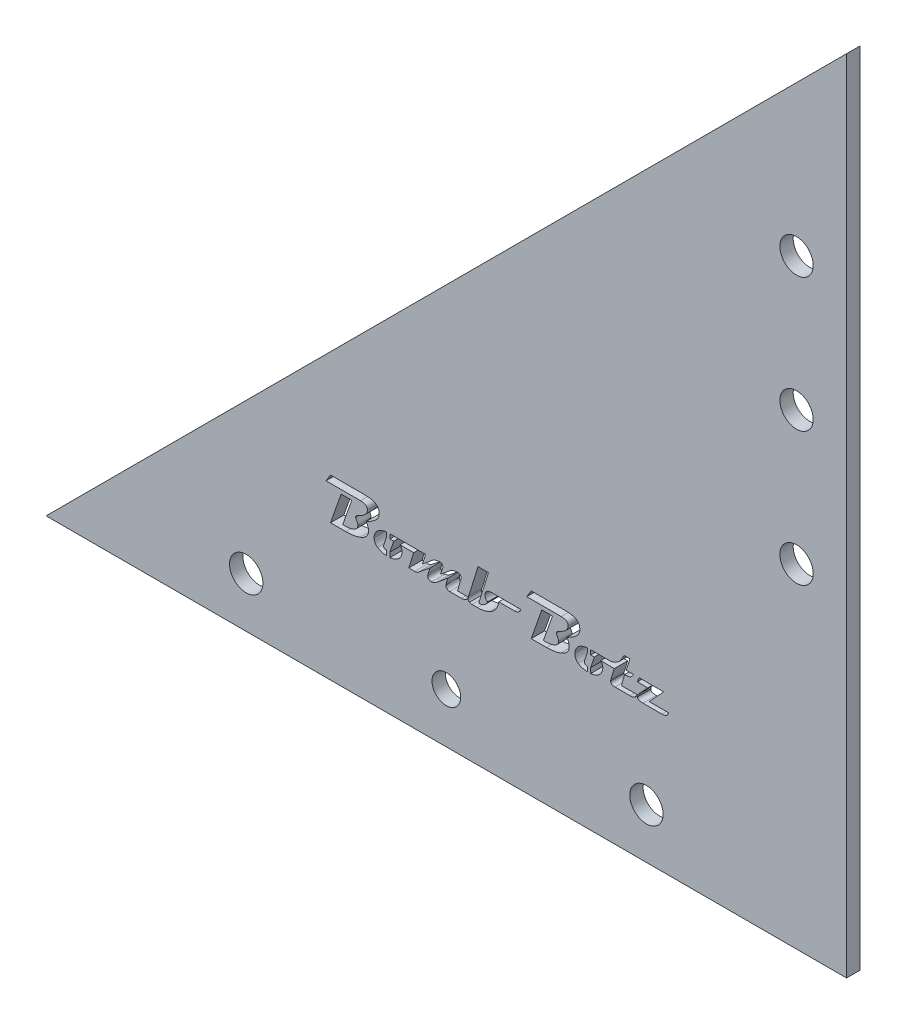
from build123d import *

# Parameters (mm, degrees)
BOSS_EXTRUDE4_DEPTH = 2.54
SKETCH5_R           = 3.175
SKETCH5_R_2         = 2.7305
CUT_EXTRUDE1_DEPTH  = 2.54
CUT_EXTRUDE2_DEPTH  = 2.54
SKETCH7_W           = 0.619174652
SKETCH7_H           = 6.165947576
SKETCH7_H_2         = 7.239183639
BOSS_EXTRUDE5_DEPTH = 2.54


with BuildPart() as part:
    # Sketch4 → Boss-Extrude4 (new body)
    with BuildSketch(Plane.XY):
        Polygon((0, 0), (-152.4, 0), (0, 152.4), align=None)
    extrude(amount=BOSS_EXTRUDE4_DEPTH)

    # Sketch5 → Cut-Extrude1 (cut)
    with BuildSketch(Plane.XY.offset(2.54)):
        with Locations((-114.3, 9.525)):
            Circle(SKETCH5_R)
        with Locations((-76.2, 9.525)):
            Circle(SKETCH5_R_2)
        with Locations((-38.1, 9.525)):
            Circle(SKETCH5_R)
        with Locations((-9.525, 63.5)):
            Circle(SKETCH5_R)
        with Locations((-9.525, 88.9)):
            Circle(SKETCH5_R)
        with Locations((-9.525, 114.3)):
            Circle(SKETCH5_R)
    extrude(amount=-CUT_EXTRUDE1_DEPTH, mode=Mode.SUBTRACT)

    # Sketch6 → Cut-Extrude2 (cut)
    # profile 1 of 8: a face of its own
    with BuildSketch(Plane.XY.offset(2.54)):
        with BuildLine():
            add(Edge.make_bspline(
                [(-88.990266717, 32.049532771), (-88.99258407, 31.981104975), (-88.997205929, 31.844628762), (-89.042360579, 31.64283784), (-89.108012122, 31.443323413), (-89.204491548, 31.247533619), (-89.328498389, 31.056607307), (-89.478600579, 30.868693199), (-89.655007282, 30.683858772), (-89.78806245, 30.568878389), (-89.856712742, 30.509553848)],
                knots=[0, 0, 0, 0, 0.897728408, 1.790479602, 2.704835107, 3.65271708, 4.64870854, 5.690615823, 6.808464946, 8, 8, 8, 8], degree=3))
            add(Edge.make_bspline(
                [(-89.856712742, 30.509553848), (-89.902357666, 30.472490027), (-89.997340119, 30.395363978), (-90.153487814, 30.284313315), (-90.325740995, 30.169660759), (-90.516604463, 30.054053788), (-90.721842787, 29.931972854), (-90.945553289, 29.809758188), (-91.184832705, 29.682348928), (-91.352088596, 29.600477238), (-91.43826777, 29.558292569)],
                knots=[0, 0, 0, 0, 0.762818378, 1.58734759, 2.485155294, 3.447475053, 4.482567251, 5.583716273, 6.755001493, 8, 8, 8, 8], degree=3))
            add(Edge.make_bspline(
                [(-91.43826777, 29.558292569), (-91.404391758, 29.49708212), (-91.338334323, 29.377723166), (-91.251975407, 29.197760359), (-91.177943071, 29.022629369), (-91.118122487, 28.851502433), (-91.071082218, 28.684928968), (-91.037519499, 28.522704698), (-91.01659801, 28.364777239), (-91.013867199, 28.260623631), (-91.012528456, 28.209563728)],
                knots=[0, 0, 0, 0, 1.174121996, 2.289510624, 3.348879741, 4.364175923, 5.330489301, 6.25208496, 7.143108216, 8, 8, 8, 8], degree=3))
            add(Edge.make_bspline(
                [(-91.012528456, 28.209563728), (-91.013948019, 28.158515543), (-91.016765299, 28.057204788), (-91.034910588, 27.90791384), (-91.066555381, 27.763624872), (-91.112116762, 27.625356879), (-91.168369313, 27.491269537), (-91.239041417, 27.363250082), (-91.320661802, 27.239241889), (-91.416060845, 27.120820998), (-91.524659529, 27.008089381), (-91.644836722, 26.899174898), (-91.778379643, 26.796790707), (-91.923078011, 26.697691275), (-92.082611543, 26.607079716), (-92.252870096, 26.51858755), (-92.43725306, 26.437288651), (-92.565062363, 26.387486479), (-92.630670456, 26.361921629)],
                knots=[0, 0, 0, 0, 0.930762157, 1.847200212, 2.737400411, 3.619588674, 4.498179705, 5.384699949, 6.281759375, 7.202035291, 8.152832479, 9.1332533, 10.156253164, 11.218736018, 12.328253921, 13.499059235, 14.716197083, 16, 16, 16, 16], degree=3))
            add(Edge.make_bspline(
                [(-92.630670456, 26.361921629), (-92.729013905, 26.327633758), (-92.927463242, 26.258443535), (-93.235175184, 26.17236287), (-93.554334467, 26.099399446), (-93.886191157, 26.039505667), (-94.22971285, 25.993373177), (-94.585329856, 25.960224767), (-94.952594658, 25.939880247), (-95.201710438, 25.937427168), (-95.328128138, 25.936182315)],
                knots=[0, 0, 0, 0, 0.910500009, 1.837317329, 2.792105238, 3.772355063, 4.784863345, 5.821858577, 6.894668061, 8, 8, 8, 8], degree=3))
            Line((-95.328128138, 25.936182315), (-98.250096786, 25.936182315))
            Line((-98.250096786, 25.936182315), (-96.227835047, 31.683663048))
            Line((-96.227835047, 31.683663048), (-94.203910263, 31.683663048))
            Line((-94.203910263, 31.683663048), (-95.930150136, 26.787660943))
            Line((-95.930150136, 26.787660943), (-95.649095667, 26.787660943))
            add(Edge.make_bspline(
                [(-95.649095667, 26.787660943), (-95.494884497, 26.79061617), (-95.197513283, 26.796314846), (-94.770426446, 26.83724289), (-94.37895271, 26.906116318), (-94.136254238, 26.979931078), (-94.019312358, 27.015497997)],
                knots=[0, 0, 0, 0, 1.119726035, 2.159209934, 3.113033349, 4, 4, 4, 4], degree=3))
            add(Edge.make_bspline(
                [(-94.019312358, 27.015497997), (-93.941432269, 27.044671927), (-93.792627284, 27.100414368), (-93.591640936, 27.210021327), (-93.419589049, 27.330618971), (-93.279297267, 27.46706624), (-93.167925032, 27.616712251), (-93.09140043, 27.782769023), (-93.04233138, 27.961747588), (-93.037338983, 28.086171514), (-93.034790195, 28.149694137)],
                knots=[0, 0, 0, 0, 1.235683897, 2.361013278, 3.395291283, 4.351587988, 5.260345797, 6.153024808, 7.057056699, 8, 8, 8, 8], degree=3))
            add(Edge.make_bspline(
                [(-93.034790195, 28.149694137), (-93.037689645, 28.19373665), (-93.043884573, 28.287837348), (-93.087497269, 28.433136878), (-93.154506903, 28.590361529), (-93.246590848, 28.749009815), (-93.338008623, 28.902116406), (-93.404687985, 29.04209426), (-93.449509744, 29.158200046), (-93.457221704, 29.229867947), (-93.460529509, 29.260607658)],
                knots=[0, 0, 0, 0, 0.878868266, 1.877779235, 3.008481529, 4.286715377, 5.53601311, 6.565782224, 7.38483702, 8, 8, 8, 8], degree=3))
            add(Edge.make_bspline(
                [(-93.460529509, 29.260607658), (-93.460330013, 29.283441804), (-93.459997068, 29.321550572), (-93.452066787, 29.358774642), (-93.4488882, 29.373694663)],
                knots=[0, 0, 0, 0, 1.198367028, 2, 2, 2, 2], degree=3))
            add(Edge.make_bspline(
                [(-93.4488882, 29.373694663), (-93.422932547, 29.41611854), (-93.365517701, 29.509961698), (-93.226822663, 29.631976678), (-93.041491702, 29.750232249), (-92.898161347, 29.820895964), (-92.820257494, 29.859303568)],
                knots=[0, 0, 0, 0, 0.735710686, 1.627418776, 2.710439134, 4, 4, 4, 4], degree=3))
            add(Edge.make_bspline(
                [(-92.820257494, 29.859303568), (-92.708703649, 29.912320181), (-92.499170866, 30.011901853), (-92.215584493, 30.170932792), (-91.975454535, 30.317296797), (-91.84093177, 30.425136371), (-91.779191829, 30.47462992)],
                knots=[0, 0, 0, 0, 1.221943044, 2.295188721, 3.217567763, 4, 4, 4, 4], degree=3))
            add(Edge.make_bspline(
                [(-91.779191829, 30.47462992), (-91.7351955, 30.513756988), (-91.649239337, 30.590200018), (-91.536251891, 30.715113556), (-91.440286868, 30.844240291), (-91.361109451, 30.977556925), (-91.300933385, 31.116939737), (-91.257930731, 31.260372131), (-91.229569519, 31.408148007), (-91.226797253, 31.508359036), (-91.225398113, 31.558934734)],
                knots=[0, 0, 0, 0, 1.121998031, 2.192061215, 3.204672358, 4.185392352, 5.141656817, 6.09129737, 7.036693171, 8, 8, 8, 8], degree=3))
            add(Edge.make_bspline(
                [(-91.225398113, 31.558934734), (-91.226391014, 31.593893596), (-91.228339034, 31.662480984), (-91.242509552, 31.762227068), (-91.270369155, 31.854246475), (-91.304440664, 31.940691362), (-91.352020735, 32.019022167), (-91.408910355, 32.091741818), (-91.477225459, 32.156040218), (-91.5557071, 32.213503924), (-91.642957672, 32.264813126), (-91.741616123, 32.307848419), (-91.849028717, 32.346689709), (-91.96864329, 32.375354937), (-92.097150883, 32.401014635), (-92.236763372, 32.41680496), (-92.386046898, 32.426980803), (-92.489292593, 32.428119633), (-92.542529114, 32.428706847)],
                knots=[0, 0, 0, 0, 0.937953779, 1.840214304, 2.692042798, 3.512259584, 4.325843598, 5.141056955, 5.982567789, 6.83322717, 7.746330073, 8.691564934, 9.716930283, 10.806196192, 11.987412167, 13.230656729, 14.572045042, 16, 16, 16, 16], degree=3))
            Line((-92.542529114, 32.428706847), (-99.101575413, 32.428706847))
            Line((-99.101575413, 32.428706847), (-98.240118521, 33.812359616))
            Line((-98.240118521, 33.812359616), (-91.709343973, 33.812359616))
            add(Edge.make_bspline(
                [(-91.709343973, 33.812359616), (-91.605653924, 33.811623058), (-91.404228418, 33.810192241), (-91.112440789, 33.792899496), (-90.840376347, 33.767297555), (-90.588764002, 33.729433139), (-90.357178262, 33.679717149), (-90.145544644, 33.619870607), (-89.952461557, 33.551864365), (-89.835136454, 33.493117459), (-89.778549664, 33.464783379)],
                knots=[0, 0, 0, 0, 1.256746755, 2.441322517, 3.541898803, 4.568277561, 5.523823565, 6.410850237, 7.23354099, 8, 8, 8, 8], degree=3))
            add(Edge.make_bspline(
                [(-89.778549664, 33.464783379), (-89.715787471, 33.428337616), (-89.593016655, 33.357045077), (-89.432614946, 33.221225916), (-89.293971452, 33.070915367), (-89.181036465, 32.901139136), (-89.096589651, 32.712292707), (-89.035141775, 32.50719125), (-88.99543347, 32.284438173), (-88.992026382, 32.129535579), (-88.990266717, 32.049532771)],
                knots=[0, 0, 0, 0, 1.016794796, 1.988979663, 2.936190502, 3.879110517, 4.836521918, 5.828337036, 6.878397495, 8, 8, 8, 8], degree=3))
        make_face()
    # profile 2 of 8: a face of its own
    with BuildSketch(Plane.XY.offset(2.54)):
        with BuildLine():
            add(Edge.make_bspline(
                [(-80.156175961, 29.767836137), (-80.176972501, 29.700313421), (-80.217327703, 29.569287164), (-80.318022326, 29.393143269), (-80.446436483, 29.243601081), (-80.604593632, 29.122089679), (-80.790958471, 29.028474491), (-81.004578311, 28.963117631), (-81.245623646, 28.922831362), (-81.415482439, 28.918590249), (-81.504904802, 28.91635751)],
                knots=[0, 0, 0, 0, 0.974814121, 1.891604083, 2.783133621, 3.684923962, 4.631341703, 5.652256529, 6.764027661, 8, 8, 8, 8], degree=3))
            Line((-81.504904802, 28.91635751), (-85.023906315, 28.91635751))
            add(Edge.make_bspline(
                [(-85.023906315, 28.91635751), (-84.99336804, 28.892013761), (-84.92870982, 28.840471117), (-84.850487676, 28.733555833), (-84.778069516, 28.603652087), (-84.719022105, 28.452430541), (-84.670680321, 28.294912485), (-84.636449973, 28.143323992), (-84.619294518, 28.001999529), (-84.624121251, 27.911899968), (-84.626438753, 27.868639668)],
                knots=[0, 0, 0, 0, 0.806255924, 1.70707325, 2.720293289, 3.885133511, 5.06259621, 6.133017354, 7.103589112, 8, 8, 8, 8], degree=3))
            add(Edge.make_bspline(
                [(-84.626438753, 27.868639668), (-84.634843127, 27.790237585), (-84.651251115, 27.637172006), (-84.702044299, 27.415229962), (-84.773655794, 27.206043477), (-84.866604686, 27.009495737), (-84.981335152, 26.826566601), (-85.114854855, 26.655849138), (-85.270187641, 26.497885048), (-85.388093373, 26.406617273), (-85.447982585, 26.360258585)],
                knots=[0, 0, 0, 0, 1.065603711, 2.080394318, 3.07136878, 4.05053362, 5.01363956, 5.985430025, 6.976716351, 8, 8, 8, 8], degree=3))
            add(Edge.make_bspline(
                [(-85.447982585, 26.360258585), (-85.508114482, 26.317876948), (-85.629532141, 26.232300417), (-85.828976418, 26.127949389), (-86.039442537, 26.034726023), (-86.264173325, 25.960958414), (-86.502047442, 25.902190228), (-86.752893879, 25.86143775), (-87.01739046, 25.836231294), (-87.198002217, 25.831945575), (-87.290635551, 25.829747487)],
                knots=[0, 0, 0, 0, 0.904482485, 1.826320996, 2.764277135, 3.735128293, 4.732909638, 5.77712291, 6.859916316, 8, 8, 8, 8], degree=3))
            add(Edge.make_bspline(
                [(-87.290635551, 25.829747487), (-87.397122019, 25.829976067), (-87.604281721, 25.830420749), (-87.905793879, 25.854841655), (-88.188995701, 25.893014807), (-88.452118518, 25.952059302), (-88.697575985, 26.024359423), (-88.923373934, 26.116101006), (-89.132440658, 26.222707503), (-89.256771365, 26.311582657), (-89.317886423, 26.355269452)],
                knots=[0, 0, 0, 0, 1.198628162, 2.331821666, 3.403500158, 4.413659066, 5.365491277, 6.281208672, 7.155123997, 8, 8, 8, 8], degree=3))
            add(Edge.make_bspline(
                [(-89.317886423, 26.355269452), (-89.368217114, 26.395165435), (-89.466830672, 26.473334136), (-89.59543588, 26.607788647), (-89.704335841, 26.751221805), (-89.793183526, 26.904430404), (-89.864149489, 27.06581707), (-89.911489392, 27.237905806), (-89.942923555, 27.418466141), (-89.946403753, 27.542544566), (-89.948180172, 27.605878686)],
                knots=[0, 0, 0, 0, 1.057900847, 2.072758456, 3.058045874, 4.020559661, 4.986668567, 5.955885328, 6.956609876, 8, 8, 8, 8], degree=3))
            add(Edge.make_bspline(
                [(-89.948180172, 27.605878686), (-89.947188523, 27.656991688), (-89.945196318, 27.759676732), (-89.928362804, 27.860993814), (-89.919908421, 27.911878817)],
                knots=[0, 0, 0, 0, 0.995529625, 2, 2, 2, 2], degree=3))
            add(Edge.make_bspline(
                [(-89.919908421, 27.911878817), (-89.906225087, 27.981475496), (-89.879309728, 28.118373383), (-89.817384239, 28.315875347), (-89.736622349, 28.501448426), (-89.640690157, 28.676378063), (-89.526672011, 28.839523789), (-89.393642027, 28.989062595), (-89.246575796, 29.13028008), (-89.135934819, 29.211356272), (-89.080071103, 29.252292437)],
                knots=[0, 0, 0, 0, 1.046248039, 2.057988234, 3.047385253, 4.028766979, 4.997932427, 5.977675898, 6.978908713, 8, 8, 8, 8], degree=3))
            add(Edge.make_bspline(
                [(-89.080071103, 29.252292437), (-89.016539664, 29.294064585), (-88.888123174, 29.378498886), (-88.678509143, 29.48254106), (-88.454081286, 29.570662283), (-88.214753443, 29.644577498), (-87.958812898, 29.69735789), (-87.689349213, 29.740479326), (-87.403542431, 29.762725575), (-87.208069352, 29.766102304), (-87.10770069, 29.767836137)],
                knots=[0, 0, 0, 0, 0.880847075, 1.780461621, 2.70656802, 3.674265997, 4.68017856, 5.733644912, 6.836305091, 8, 8, 8, 8], degree=3))
            Line((-87.10770069, 29.767836137), (-80.156175961, 29.767836137))
        make_face()
        with BuildLine():
            Line((-86.222961179, 28.91635751), (-87.606613948, 28.91635751))
            Line((-87.606613948, 28.91635751), (-88.100538073, 27.411302515))
            add(Edge.make_bspline(
                [(-88.100538073, 27.411302515), (-88.111477418, 27.373306572), (-88.132618563, 27.299876422), (-88.136779973, 27.223599489), (-88.13878809, 27.186791549)],
                knots=[0, 0, 0, 0, 1.034886721, 2, 2, 2, 2], degree=3))
            add(Edge.make_bspline(
                [(-88.13878809, 27.186791549), (-88.136318059, 27.146887084), (-88.131500129, 27.069051263), (-88.081391705, 26.96217022), (-88.002677541, 26.871782483), (-87.892431238, 26.800418229), (-87.752501554, 26.746572076), (-87.584004409, 26.707962321), (-87.385466848, 26.685585074), (-87.243577767, 26.682746623), (-87.167570281, 26.681226114)],
                knots=[0, 0, 0, 0, 0.780468762, 1.522346627, 2.272276054, 3.11311277, 4.077040892, 5.209140603, 6.50498569, 8, 8, 8, 8], degree=3))
            add(Edge.make_bspline(
                [(-87.167570281, 26.681226114), (-87.131524333, 26.681399264), (-87.064936243, 26.681719126), (-86.998484556, 26.685941571), (-86.968004978, 26.687878291)],
                knots=[0, 0, 0, 0, 1.082654509, 2, 2, 2, 2], degree=3))
            Line((-86.968004978, 26.687878291), (-86.222961179, 28.91635751))
        make_face(mode=Mode.SUBTRACT)
    # profile 3 of 8: a face of its own
    with BuildSketch(Plane.XY.offset(2.54)):
        with BuildLine():
            add(Edge.make_bspline(
                [(-72.067129004, 26.787660943), (-72.082950399, 26.720346702), (-72.113441453, 26.590618441), (-72.198386999, 26.413663113), (-72.313578063, 26.26357025), (-72.460113185, 26.142190534), (-72.635377453, 26.047899233), (-72.839397166, 25.982715908), (-73.071708135, 25.942643685), (-73.236070862, 25.9384129), (-73.32272737, 25.936182315)],
                knots=[0, 0, 0, 0, 0.99149646, 1.910815747, 2.796806556, 3.690358489, 4.624369187, 5.639649257, 6.75555877, 8, 8, 8, 8], degree=3))
            Line((-73.32272737, 25.936182315), (-75.566173987, 25.936182315))
            add(Edge.make_bspline(
                [(-75.566173987, 25.936182315), (-75.609708205, 25.938784538), (-75.697493013, 25.944031804), (-75.825534032, 25.986011808), (-75.947413952, 26.054486466), (-76.058929183, 26.146407858), (-76.157058276, 26.253111481), (-76.227051341, 26.373081599), (-76.274874584, 26.499212377), (-76.279138127, 26.58711404), (-76.28128299, 26.631334788)],
                knots=[0, 0, 0, 0, 0.953018249, 1.921718768, 2.922818182, 4.002921641, 5.078914059, 6.081561737, 7.034889961, 8, 8, 8, 8], degree=3))
            add(Edge.make_bspline(
                [(-76.28128299, 26.631334788), (-76.279903006, 26.659722699), (-76.277147526, 26.716406166), (-76.26437582, 26.771700253), (-76.258000371, 26.799302252)],
                knots=[0, 0, 0, 0, 1.001629293, 2, 2, 2, 2], degree=3))
            add(Edge.make_bspline(
                [(-76.258000371, 26.799302252), (-76.238146606, 26.873612815), (-76.194548758, 27.036794988), (-76.120601811, 27.303781486), (-76.034511733, 27.615986783), (-75.972036348, 27.839281265), (-75.938695886, 27.958444055)],
                knots=[0, 0, 0, 0, 0.76768028, 1.685786406, 2.765002404, 4, 4, 4, 4], degree=3))
            Line((-75.938695886, 27.958444055), (-77.79631625, 26.410149911))
            add(Edge.make_bspline(
                [(-77.79631625, 26.410149911), (-77.853497085, 26.364080531), (-77.963628905, 26.27534967), (-78.13021235, 26.157085953), (-78.289892881, 26.056665005), (-78.443418199, 25.974043307), (-78.590976214, 25.910570367), (-78.73238093, 25.865247403), (-78.867069495, 25.834213868), (-78.955858114, 25.8312011), (-78.998697202, 25.829747487)],
                knots=[0, 0, 0, 0, 1.296105666, 2.496334262, 3.604237583, 4.624332256, 5.571396642, 6.434881891, 7.244855559, 8, 8, 8, 8], degree=3))
            add(Edge.make_bspline(
                [(-78.998697202, 25.829747487), (-79.056993107, 25.83179032), (-79.167049588, 25.835646972), (-79.321171325, 25.860478238), (-79.452475956, 25.906841211), (-79.559752881, 25.973033211), (-79.647171495, 26.055685041), (-79.705699256, 26.161414235), (-79.741455165, 26.284234953), (-79.745132222, 26.372185532), (-79.747067089, 26.418465132)],
                knots=[0, 0, 0, 0, 1.288056299, 2.431713562, 3.435164107, 4.342616441, 5.200009575, 6.06132992, 6.979871696, 8, 8, 8, 8], degree=3))
            add(Edge.make_bspline(
                [(-79.747067089, 26.418465132), (-79.742481075, 26.485497939), (-79.732759617, 26.627594438), (-79.687711784, 26.762801757), (-79.66391488, 26.83422618)],
                knots=[0, 0, 0, 0, 0.943482878, 2, 2, 2, 2], degree=3))
            Line((-79.66391488, 26.83422618), (-79.304697334, 27.958444055))
            Line((-79.304697334, 27.958444055), (-81.513220023, 26.167345458))
            add(Edge.make_bspline(
                [(-81.513220023, 26.167345458), (-81.561830658, 26.131342772), (-81.65952052, 26.058990345), (-81.831794618, 25.989218367), (-82.018673859, 25.944246536), (-82.149326659, 25.938925631), (-82.216687717, 25.936182315)],
                knots=[0, 0, 0, 0, 0.958271537, 1.925780514, 2.93058841, 4, 4, 4, 4], degree=3))
            Line((-82.216687717, 25.936182315), (-83.349220812, 25.936182315))
            Line((-83.349220812, 25.936182315), (-82.15848117, 29.767836137))
            Line((-82.15848117, 29.767836137), (-80.162828138, 29.767836137))
            Line((-80.162828138, 29.767836137), (-80.749882738, 27.863650536))
            Line((-80.749882738, 27.863650536), (-79.005349379, 29.323803338))
            add(Edge.make_bspline(
                [(-79.005349379, 29.323803338), (-78.950705447, 29.368122189), (-78.843118993, 29.455379965), (-78.670457025, 29.56582453), (-78.495319809, 29.662740141), (-78.31311684, 29.738623116), (-78.12625665, 29.799097636), (-77.93473142, 29.84180687), (-77.738401462, 29.870158339), (-77.605720771, 29.872888621), (-77.5385444, 29.874270966)],
                knots=[0, 0, 0, 0, 1.054420173, 2.076009588, 3.069330367, 4.052965778, 5.031069067, 6.011325487, 6.993132056, 8, 8, 8, 8], degree=3))
            add(Edge.make_bspline(
                [(-77.5385444, 29.874270966), (-77.486298397, 29.873553055), (-77.38785841, 29.872200394), (-77.250739741, 29.847707879), (-77.132187326, 29.814037995), (-77.036510374, 29.759034275), (-76.96018926, 29.691316112), (-76.904948925, 29.606773583), (-76.873097343, 29.506155867), (-76.869966836, 29.434348715), (-76.86833759, 29.396977282)],
                knots=[0, 0, 0, 0, 1.338371947, 2.521710924, 3.565490147, 4.482983206, 5.328870011, 6.161374167, 7.043102513, 8, 8, 8, 8], degree=3))
            add(Edge.make_bspline(
                [(-76.86833759, 29.396977282), (-76.871289749, 29.34889703), (-76.87759051, 29.24627986), (-76.911727684, 29.149215271), (-76.929870226, 29.097629327)],
                knots=[0, 0, 0, 0, 0.937080074, 2, 2, 2, 2], degree=3))
            Line((-76.929870226, 29.097629327), (-77.304055169, 27.926846215))
            Line((-77.304055169, 27.926846215), (-75.551206589, 29.352075089))
            add(Edge.make_bspline(
                [(-75.551206589, 29.352075089), (-75.498211592, 29.394175547), (-75.393878101, 29.477060498), (-75.225623356, 29.581460546), (-75.054344999, 29.671275818), (-74.879413468, 29.747566446), (-74.698589379, 29.804007658), (-74.513648363, 29.843200097), (-74.324640772, 29.869741804), (-74.197024795, 29.872752016), (-74.132629892, 29.874270966)],
                knots=[0, 0, 0, 0, 1.052193059, 2.071496925, 3.074470867, 4.0596751, 5.036158861, 6.01557073, 6.998658842, 8, 8, 8, 8], degree=3))
            add(Edge.make_bspline(
                [(-74.132629892, 29.874270966), (-74.074844621, 29.87253155), (-73.966798035, 29.8692792), (-73.815799832, 29.84111292), (-73.687059715, 29.794912216), (-73.578820021, 29.73044387), (-73.495663884, 29.642138514), (-73.439496652, 29.534267984), (-73.402884525, 29.409282261), (-73.39940484, 29.319654865), (-73.397564359, 29.272248968)],
                knots=[0, 0, 0, 0, 1.276739742, 2.387241022, 3.379898468, 4.287998429, 5.146353526, 6.02374704, 6.954716408, 8, 8, 8, 8], degree=3))
            add(Edge.make_bspline(
                [(-73.397564359, 29.272248968), (-73.398466107, 29.237262531), (-73.400322244, 29.16524727), (-73.418167821, 29.055041781), (-73.4465249, 28.939338968), (-73.47340396, 28.861832048), (-73.487368745, 28.821563991)],
                knots=[0, 0, 0, 0, 0.90837764, 1.869783218, 2.893264101, 4, 4, 4, 4], degree=3))
            Line((-73.487368745, 28.821563991), (-74.06444508, 26.787660943))
            Line((-74.06444508, 26.787660943), (-72.067129004, 26.787660943))
        make_face()
    # profile 4 of 8: a face of its own
    with BuildSketch(Plane.XY.offset(2.54)):
        with BuildLine():
            add(Edge.make_bspline(
                [(-61.955820307, 29.767836137), (-61.987281767, 29.700334553), (-62.048140945, 29.569759208), (-62.166135987, 29.395696113), (-62.29801746, 29.247079213), (-62.446061473, 29.12559751), (-62.609896014, 29.030636093), (-62.789930453, 28.964421993), (-62.985609595, 28.923258552), (-63.121402416, 28.918706206), (-63.191462143, 28.91635751)],
                knots=[0, 0, 0, 0, 1.115206191, 2.157259482, 3.14025187, 4.085366729, 5.016376528, 5.965904001, 6.950546796, 8, 8, 8, 8], degree=3))
            Line((-63.191462143, 28.91635751), (-66.213213443, 28.91635751))
            add(Edge.make_bspline(
                [(-66.213213443, 28.91635751), (-66.234510747, 28.783749703), (-66.276212839, 28.524091347), (-66.390100675, 28.152890167), (-66.537758881, 27.807157572), (-66.725108032, 27.488795314), (-66.951918702, 27.198385665), (-67.217257261, 26.936789599), (-67.51770518, 26.698686277), (-67.741957589, 26.569268766), (-67.856301106, 26.503280385)],
                knots=[0, 0, 0, 0, 1.059465003, 2.074530497, 3.056825323, 4.022268175, 4.982836178, 5.957847538, 6.958731833, 8, 8, 8, 8], degree=3))
            add(Edge.make_bspline(
                [(-67.856301106, 26.503280385), (-67.944919215, 26.457588635), (-68.122605319, 26.365973172), (-68.402363184, 26.252132327), (-68.691478956, 26.153643098), (-68.992565952, 26.073310599), (-69.304502926, 26.01302632), (-69.626906978, 25.967534455), (-69.960136691, 25.940459424), (-70.186176212, 25.93762291), (-70.30097607, 25.936182315)],
                knots=[0, 0, 0, 0, 0.943308606, 1.891406092, 2.855442252, 3.832907148, 4.83826654, 5.860799809, 6.913553353, 8, 8, 8, 8], degree=3))
            Line((-70.30097607, 25.936182315), (-71.315433028, 25.936182315))
            add(Edge.make_bspline(
                [(-71.315433028, 25.936182315), (-71.359334325, 25.937773563), (-71.445654589, 25.94090233), (-71.571026454, 25.965691395), (-71.687802824, 26.009779644), (-71.75884664, 26.050511039), (-71.794389756, 26.070888895)],
                knots=[0, 0, 0, 0, 1.044289679, 2.053318855, 3.026078302, 4, 4, 4, 4], degree=3))
            add(Edge.make_bspline(
                [(-71.794389756, 26.070888895), (-71.836511997, 26.102519651), (-71.919118746, 26.164551343), (-72.00503196, 26.295767903), (-72.059779389, 26.447500887), (-72.064596044, 26.55707961), (-72.067129004, 26.614704346)],
                knots=[0, 0, 0, 0, 0.988520934, 1.938607685, 2.91596484, 4, 4, 4, 4], degree=3))
            add(Edge.make_bspline(
                [(-72.067129004, 26.614704346), (-72.065662127, 26.650923718), (-72.062596264, 26.726624453), (-72.030910522, 26.841722378), (-71.986678956, 26.964262792), (-71.944544955, 27.044776544), (-71.922444159, 27.087008897)],
                knots=[0, 0, 0, 0, 0.869358243, 1.817012681, 2.854944787, 4, 4, 4, 4], degree=3))
            Line((-71.922444159, 27.087008897), (-70.162943402, 32.748011332))
            Line((-70.162943402, 32.748011332), (-68.183920812, 32.748011332))
            Line((-68.183920812, 32.748011332), (-70.02324769, 26.789323987))
            add(Edge.make_bspline(
                [(-70.02324769, 26.789323987), (-69.928232011, 26.789757455), (-69.744110989, 26.790597427), (-69.478308887, 26.839516773), (-69.232693721, 26.918377438), (-69.007753641, 27.034433017), (-68.806799882, 27.188376044), (-68.626303632, 27.37572987), (-68.469315703, 27.599320158), (-68.385271475, 27.76600861), (-68.34191001, 27.852009226)],
                knots=[0, 0, 0, 0, 1.07249176, 2.078270447, 3.041590553, 3.98074896, 4.924726752, 5.891100823, 6.911942458, 8, 8, 8, 8], degree=3))
            add(Edge.make_bspline(
                [(-68.34191001, 27.852009226), (-68.384207583, 27.878721433), (-68.466460305, 27.930666534), (-68.574611459, 28.023165889), (-68.667847128, 28.121640652), (-68.743001994, 28.228862921), (-68.802012858, 28.342930805), (-68.843984636, 28.464404859), (-68.869499426, 28.593213976), (-68.872538729, 28.681751129), (-68.874084152, 28.726770472)],
                knots=[0, 0, 0, 0, 1.115441843, 2.169110959, 3.167252835, 4.135411278, 5.081814168, 6.024975387, 6.995740126, 8, 8, 8, 8], degree=3))
            add(Edge.make_bspline(
                [(-68.874084152, 28.726770472), (-68.869992065, 28.796578041), (-68.861925392, 28.934188715), (-68.795464197, 29.131317207), (-68.688295778, 29.312062068), (-68.539484383, 29.468426545), (-68.365462864, 29.602322722), (-68.167513678, 29.696944108), (-67.954263641, 29.759033319), (-67.805745459, 29.764860624), (-67.729909747, 29.767836137)],
                knots=[0, 0, 0, 0, 0.974106845, 1.920243053, 2.876013814, 3.890691073, 4.920035158, 5.928803845, 6.942414768, 8, 8, 8, 8], degree=3))
            Line((-67.729909747, 29.767836137), (-61.955820307, 29.767836137))
        make_face()
    # profile 5 of 8: a face of its own
    with BuildSketch(Plane.XY.offset(2.54)):
        with BuildLine():
            add(Edge.make_bspline(
                [(-50.780163327, 32.049532771), (-50.78248068, 31.981104975), (-50.787102539, 31.844628762), (-50.83225719, 31.64283784), (-50.897908733, 31.443323413), (-50.994388158, 31.247533619), (-51.118395, 31.056607307), (-51.268497189, 30.868693199), (-51.444903893, 30.683858772), (-51.577959061, 30.568878389), (-51.646609352, 30.509553848)],
                knots=[0, 0, 0, 0, 0.897728408, 1.790479602, 2.704835107, 3.65271708, 4.64870854, 5.690615823, 6.808464946, 8, 8, 8, 8], degree=3))
            add(Edge.make_bspline(
                [(-51.646609352, 30.509553848), (-51.692254276, 30.472490027), (-51.787236729, 30.395363978), (-51.943384424, 30.284313315), (-52.115637605, 30.169660759), (-52.306501073, 30.054053788), (-52.511739397, 29.931972854), (-52.735449899, 29.809758188), (-52.974729316, 29.682348928), (-53.141985207, 29.600477238), (-53.22816438, 29.558292569)],
                knots=[0, 0, 0, 0, 0.762818378, 1.58734759, 2.485155294, 3.447475053, 4.482567251, 5.583716273, 6.755001493, 8, 8, 8, 8], degree=3))
            add(Edge.make_bspline(
                [(-53.22816438, 29.558292569), (-53.194288369, 29.49708212), (-53.128230933, 29.377723166), (-53.041872017, 29.197760359), (-52.967839682, 29.022629369), (-52.908019097, 28.851502433), (-52.860978829, 28.684928968), (-52.827416109, 28.522704698), (-52.80649462, 28.364777239), (-52.80376381, 28.260623631), (-52.802425067, 28.209563728)],
                knots=[0, 0, 0, 0, 1.174121996, 2.289510624, 3.348879741, 4.364175923, 5.330489301, 6.25208496, 7.143108216, 8, 8, 8, 8], degree=3))
            add(Edge.make_bspline(
                [(-52.802425067, 28.209563728), (-52.80384463, 28.158515543), (-52.806661909, 28.057204788), (-52.824807198, 27.90791384), (-52.856451991, 27.763624872), (-52.902013372, 27.625356879), (-52.958265923, 27.491269537), (-53.028938027, 27.363250082), (-53.110558413, 27.239241889), (-53.205957456, 27.120820998), (-53.314556139, 27.008089381), (-53.434733332, 26.899174898), (-53.568276253, 26.796790707), (-53.712974622, 26.697691275), (-53.872508154, 26.607079716), (-54.042766707, 26.51858755), (-54.227149671, 26.437288651), (-54.354958973, 26.387486479), (-54.420567067, 26.361921629)],
                knots=[0, 0, 0, 0, 0.930762157, 1.847200212, 2.737400411, 3.619588674, 4.498179705, 5.384699949, 6.281759375, 7.202035291, 8.152832479, 9.1332533, 10.156253164, 11.218736018, 12.328253921, 13.499059235, 14.716197083, 16, 16, 16, 16], degree=3))
            add(Edge.make_bspline(
                [(-54.420567067, 26.361921629), (-54.518910516, 26.327633758), (-54.717359853, 26.258443535), (-55.025071794, 26.17236287), (-55.344231078, 26.099399446), (-55.676087767, 26.039505667), (-56.01960946, 25.993373177), (-56.375226467, 25.960224767), (-56.742491269, 25.939880247), (-56.991607049, 25.937427168), (-57.118024749, 25.936182315)],
                knots=[0, 0, 0, 0, 0.910500009, 1.837317329, 2.792105238, 3.772355063, 4.784863345, 5.821858577, 6.894668061, 8, 8, 8, 8], degree=3))
            Line((-57.118024749, 25.936182315), (-60.039993397, 25.936182315))
            Line((-60.039993397, 25.936182315), (-58.017731657, 31.683663048))
            Line((-58.017731657, 31.683663048), (-55.993806874, 31.683663048))
            Line((-55.993806874, 31.683663048), (-57.720046747, 26.787660943))
            Line((-57.720046747, 26.787660943), (-57.438992278, 26.787660943))
            add(Edge.make_bspline(
                [(-57.438992278, 26.787660943), (-57.284781108, 26.79061617), (-56.987409893, 26.796314846), (-56.560323057, 26.83724289), (-56.168849321, 26.906116318), (-55.926150849, 26.979931078), (-55.809208968, 27.015497997)],
                knots=[0, 0, 0, 0, 1.119726035, 2.159209934, 3.113033349, 4, 4, 4, 4], degree=3))
            add(Edge.make_bspline(
                [(-55.809208968, 27.015497997), (-55.73132888, 27.044671927), (-55.582523895, 27.100414368), (-55.381537547, 27.210021327), (-55.20948566, 27.330618971), (-55.069193878, 27.46706624), (-54.957821643, 27.616712251), (-54.881297041, 27.782769023), (-54.83222799, 27.961747588), (-54.827235593, 28.086171514), (-54.824686806, 28.149694137)],
                knots=[0, 0, 0, 0, 1.235683897, 2.361013278, 3.395291283, 4.351587988, 5.260345797, 6.153024808, 7.057056699, 8, 8, 8, 8], degree=3))
            add(Edge.make_bspline(
                [(-54.824686806, 28.149694137), (-54.827586255, 28.19373665), (-54.833781183, 28.287837348), (-54.877393879, 28.433136878), (-54.944403514, 28.590361529), (-55.036487459, 28.749009815), (-55.127905234, 28.902116406), (-55.194584595, 29.04209426), (-55.239406354, 29.158200046), (-55.247118314, 29.229867947), (-55.250426119, 29.260607658)],
                knots=[0, 0, 0, 0, 0.878868266, 1.877779235, 3.008481529, 4.286715377, 5.53601311, 6.565782224, 7.38483702, 8, 8, 8, 8], degree=3))
            add(Edge.make_bspline(
                [(-55.250426119, 29.260607658), (-55.250226624, 29.283441804), (-55.249893679, 29.321550572), (-55.241963397, 29.358774642), (-55.23878481, 29.373694663)],
                knots=[0, 0, 0, 0, 1.198367028, 2, 2, 2, 2], degree=3))
            add(Edge.make_bspline(
                [(-55.23878481, 29.373694663), (-55.212829158, 29.41611854), (-55.155414311, 29.509961698), (-55.016719273, 29.631976678), (-54.831388312, 29.750232249), (-54.688057957, 29.820895964), (-54.610154105, 29.859303568)],
                knots=[0, 0, 0, 0, 0.735710686, 1.627418776, 2.710439134, 4, 4, 4, 4], degree=3))
            add(Edge.make_bspline(
                [(-54.610154105, 29.859303568), (-54.49860026, 29.912320181), (-54.289067477, 30.011901853), (-54.005481103, 30.170932792), (-53.765351146, 30.317296797), (-53.630828381, 30.425136371), (-53.56908844, 30.47462992)],
                knots=[0, 0, 0, 0, 1.221943044, 2.295188721, 3.217567763, 4, 4, 4, 4], degree=3))
            add(Edge.make_bspline(
                [(-53.56908844, 30.47462992), (-53.525092111, 30.513756988), (-53.439135947, 30.590200018), (-53.326148502, 30.715113556), (-53.230183478, 30.844240291), (-53.151006062, 30.977556925), (-53.090829995, 31.116939737), (-53.047827342, 31.260372131), (-53.01946613, 31.408148007), (-53.016693864, 31.508359036), (-53.015294723, 31.558934734)],
                knots=[0, 0, 0, 0, 1.121998031, 2.192061215, 3.204672358, 4.185392352, 5.141656817, 6.09129737, 7.036693171, 8, 8, 8, 8], degree=3))
            add(Edge.make_bspline(
                [(-53.015294723, 31.558934734), (-53.016287625, 31.593893596), (-53.018235644, 31.662480984), (-53.032406163, 31.762227068), (-53.060265765, 31.854246475), (-53.094337274, 31.940691362), (-53.141917346, 32.019022167), (-53.198806966, 32.091741818), (-53.267122069, 32.156040218), (-53.34560371, 32.213503924), (-53.432854283, 32.264813126), (-53.531512733, 32.307848419), (-53.638925327, 32.346689709), (-53.7585399, 32.375354937), (-53.887047494, 32.401014635), (-54.026659983, 32.41680496), (-54.175943509, 32.426980803), (-54.279189203, 32.428119633), (-54.332425725, 32.428706847)],
                knots=[0, 0, 0, 0, 0.937953779, 1.840214304, 2.692042798, 3.512259584, 4.325843598, 5.141056955, 5.982567789, 6.83322717, 7.746330073, 8.691564934, 9.716930283, 10.806196192, 11.987412167, 13.230656729, 14.572045042, 16, 16, 16, 16], degree=3))
            Line((-54.332425725, 32.428706847), (-60.891472024, 32.428706847))
            Line((-60.891472024, 32.428706847), (-60.030015131, 33.812359616))
            Line((-60.030015131, 33.812359616), (-53.499240584, 33.812359616))
            add(Edge.make_bspline(
                [(-53.499240584, 33.812359616), (-53.395550535, 33.811623058), (-53.194125028, 33.810192241), (-52.9023374, 33.792899496), (-52.630272958, 33.767297555), (-52.378660613, 33.729433139), (-52.147074873, 33.679717149), (-51.935441255, 33.619870607), (-51.742358167, 33.551864365), (-51.625033064, 33.493117459), (-51.568446275, 33.464783379)],
                knots=[0, 0, 0, 0, 1.256746755, 2.441322517, 3.541898803, 4.568277561, 5.523823565, 6.410850237, 7.23354099, 8, 8, 8, 8], degree=3))
            add(Edge.make_bspline(
                [(-51.568446275, 33.464783379), (-51.505684081, 33.428337616), (-51.382913265, 33.357045077), (-51.222511556, 33.221225916), (-51.083868062, 33.070915367), (-50.970933075, 32.901139136), (-50.886486261, 32.712292707), (-50.825038385, 32.50719125), (-50.78533008, 32.284438173), (-50.781922992, 32.129535579), (-50.780163327, 32.049532771)],
                knots=[0, 0, 0, 0, 1.016794796, 1.988979663, 2.936190502, 3.879110517, 4.836521918, 5.828337036, 6.878397495, 8, 8, 8, 8], degree=3))
        make_face()
    # profile 6 of 8: a face of its own
    with BuildSketch(Plane.XY.offset(2.54)):
        with BuildLine():
            add(Edge.make_bspline(
                [(-41.946072571, 29.767836137), (-41.966869112, 29.700313421), (-42.007224314, 29.569287164), (-42.107918936, 29.393143269), (-42.236333093, 29.243601081), (-42.394490242, 29.122089679), (-42.580855081, 29.028474491), (-42.794474922, 28.963117631), (-43.035520256, 28.922831362), (-43.205379049, 28.918590249), (-43.294801412, 28.91635751)],
                knots=[0, 0, 0, 0, 0.974814121, 1.891604083, 2.783133621, 3.684923962, 4.631341703, 5.652256529, 6.764027661, 8, 8, 8, 8], degree=3))
            Line((-43.294801412, 28.91635751), (-46.813802926, 28.91635751))
            add(Edge.make_bspline(
                [(-46.813802926, 28.91635751), (-46.78326465, 28.892013761), (-46.71860643, 28.840471117), (-46.640384287, 28.733555833), (-46.567966126, 28.603652087), (-46.508918715, 28.452430541), (-46.460576932, 28.294912485), (-46.426346583, 28.143323992), (-46.409191129, 28.001999529), (-46.414017862, 27.911899968), (-46.416335364, 27.868639668)],
                knots=[0, 0, 0, 0, 0.806255924, 1.70707325, 2.720293289, 3.885133511, 5.06259621, 6.133017354, 7.103589112, 8, 8, 8, 8], degree=3))
            add(Edge.make_bspline(
                [(-46.416335364, 27.868639668), (-46.424739738, 27.790237585), (-46.441147725, 27.637172006), (-46.491940909, 27.415229962), (-46.563552404, 27.206043477), (-46.656501296, 27.009495737), (-46.771231763, 26.826566601), (-46.904751465, 26.655849138), (-47.060084252, 26.497885048), (-47.177989984, 26.406617273), (-47.237879195, 26.360258585)],
                knots=[0, 0, 0, 0, 1.065603711, 2.080394318, 3.07136878, 4.05053362, 5.01363956, 5.985430025, 6.976716351, 8, 8, 8, 8], degree=3))
            add(Edge.make_bspline(
                [(-47.237879195, 26.360258585), (-47.298011092, 26.317876948), (-47.419428751, 26.232300417), (-47.618873028, 26.127949389), (-47.829339147, 26.034726023), (-48.054069936, 25.960958414), (-48.291944053, 25.902190228), (-48.542790489, 25.86143775), (-48.807287071, 25.836231294), (-48.987898827, 25.831945575), (-49.080532162, 25.829747487)],
                knots=[0, 0, 0, 0, 0.904482485, 1.826320996, 2.764277135, 3.735128293, 4.732909638, 5.77712291, 6.859916316, 8, 8, 8, 8], degree=3))
            add(Edge.make_bspline(
                [(-49.080532162, 25.829747487), (-49.187018629, 25.829976067), (-49.394178332, 25.830420749), (-49.69569049, 25.854841655), (-49.978892311, 25.893014807), (-50.242015128, 25.952059302), (-50.487472595, 26.024359423), (-50.713270544, 26.116101006), (-50.922337269, 26.222707503), (-51.046667976, 26.311582657), (-51.107783033, 26.355269452)],
                knots=[0, 0, 0, 0, 1.198628162, 2.331821666, 3.403500158, 4.413659066, 5.365491277, 6.281208672, 7.155123997, 8, 8, 8, 8], degree=3))
            add(Edge.make_bspline(
                [(-51.107783033, 26.355269452), (-51.158113725, 26.395165435), (-51.256727282, 26.473334136), (-51.385332491, 26.607788647), (-51.494232451, 26.751221805), (-51.583080137, 26.904430404), (-51.654046099, 27.06581707), (-51.701386002, 27.237905806), (-51.732820165, 27.418466141), (-51.736300364, 27.542544566), (-51.738076783, 27.605878686)],
                knots=[0, 0, 0, 0, 1.057900847, 2.072758456, 3.058045874, 4.020559661, 4.986668567, 5.955885328, 6.956609876, 8, 8, 8, 8], degree=3))
            add(Edge.make_bspline(
                [(-51.738076783, 27.605878686), (-51.737085133, 27.656991688), (-51.735092928, 27.759676732), (-51.718259414, 27.860993814), (-51.709805031, 27.911878817)],
                knots=[0, 0, 0, 0, 0.995529625, 2, 2, 2, 2], degree=3))
            add(Edge.make_bspline(
                [(-51.709805031, 27.911878817), (-51.696121697, 27.981475496), (-51.669206339, 28.118373383), (-51.607280849, 28.315875347), (-51.526518959, 28.501448426), (-51.430586768, 28.676378063), (-51.316568621, 28.839523789), (-51.183538638, 28.989062595), (-51.036472407, 29.13028008), (-50.925831429, 29.211356272), (-50.869967714, 29.252292437)],
                knots=[0, 0, 0, 0, 1.046248039, 2.057988234, 3.047385253, 4.028766979, 4.997932427, 5.977675898, 6.978908713, 8, 8, 8, 8], degree=3))
            add(Edge.make_bspline(
                [(-50.869967714, 29.252292437), (-50.806436274, 29.294064585), (-50.678019785, 29.378498886), (-50.468405753, 29.48254106), (-50.243977896, 29.570662283), (-50.004650054, 29.644577498), (-49.748709508, 29.69735789), (-49.479245824, 29.740479326), (-49.193439042, 29.762725575), (-48.997965962, 29.766102304), (-48.8975973, 29.767836137)],
                knots=[0, 0, 0, 0, 0.880847075, 1.780461621, 2.70656802, 3.674265997, 4.68017856, 5.733644912, 6.836305091, 8, 8, 8, 8], degree=3))
            Line((-48.8975973, 29.767836137), (-41.946072571, 29.767836137))
        make_face()
        with BuildLine():
            Line((-48.012857789, 28.91635751), (-49.396510558, 28.91635751))
            Line((-49.396510558, 28.91635751), (-49.890434684, 27.411302515))
            add(Edge.make_bspline(
                [(-49.890434684, 27.411302515), (-49.901374029, 27.373306572), (-49.922515173, 27.299876422), (-49.926676584, 27.223599489), (-49.9286847, 27.186791549)],
                knots=[0, 0, 0, 0, 1.034886721, 2, 2, 2, 2], degree=3))
            add(Edge.make_bspline(
                [(-49.9286847, 27.186791549), (-49.926214669, 27.146887084), (-49.92139674, 27.069051263), (-49.871288316, 26.96217022), (-49.792574151, 26.871782483), (-49.682327848, 26.800418229), (-49.542398165, 26.746572076), (-49.37390102, 26.707962321), (-49.175363458, 26.685585074), (-49.033474377, 26.682746623), (-48.957466891, 26.681226114)],
                knots=[0, 0, 0, 0, 0.780468762, 1.522346627, 2.272276054, 3.11311277, 4.077040892, 5.209140603, 6.50498569, 8, 8, 8, 8], degree=3))
            add(Edge.make_bspline(
                [(-48.957466891, 26.681226114), (-48.921420944, 26.681399264), (-48.854832854, 26.681719126), (-48.788381166, 26.685941571), (-48.757901588, 26.687878291)],
                knots=[0, 0, 0, 0, 1.082654509, 2, 2, 2, 2], degree=3))
            Line((-48.757901588, 26.687878291), (-48.012857789, 28.91635751))
        make_face(mode=Mode.SUBTRACT)
    # profile 7 of 8: a face of its own
    with BuildSketch(Plane.XY.offset(2.54)):
        with BuildLine():
            add(Edge.make_bspline(
                [(-39.817376004, 26.787660943), (-39.841637496, 26.720083699), (-39.888822186, 26.588656856), (-39.997766334, 26.412368958), (-40.13469819, 26.263052938), (-40.300795044, 26.142242879), (-40.493469742, 26.048610266), (-40.712931669, 25.982710928), (-40.958998837, 25.942917622), (-41.132130579, 25.938494722), (-41.222648347, 25.936182315)],
                knots=[0, 0, 0, 0, 0.968357885, 1.88329996, 2.779427003, 3.690557059, 4.64219064, 5.661278239, 6.777255559, 8, 8, 8, 8], degree=3))
            Line((-41.222648347, 25.936182315), (-44.089736537, 25.936182315))
            add(Edge.make_bspline(
                [(-44.089736537, 25.936182315), (-44.154743861, 25.937197256), (-44.277153577, 25.939108403), (-44.447373538, 25.968127076), (-44.593862771, 26.010547962), (-44.712905621, 26.076843202), (-44.808390533, 26.159294633), (-44.87574002, 26.263463242), (-44.914036958, 26.386501894), (-44.918783257, 26.474182201), (-44.921258634, 26.519910827)],
                knots=[0, 0, 0, 0, 1.349973194, 2.542018758, 3.581112567, 4.504841204, 5.353988375, 6.178924762, 7.05023975, 8, 8, 8, 8], degree=3))
            add(Edge.make_bspline(
                [(-44.921258634, 26.519910827), (-44.918382681, 26.57075949), (-44.912301252, 26.67828301), (-44.877872919, 26.780400698), (-44.859725998, 26.83422618)],
                knots=[0, 0, 0, 0, 0.945814709, 2, 2, 2, 2], degree=3))
            Line((-44.859725998, 26.83422618), (-44.212801807, 28.91635751))
            Line((-44.212801807, 28.91635751), (-45.139117423, 28.91635751))
            Line((-45.139117423, 28.91635751), (-44.808171628, 29.767836137))
            add(Edge.make_bspline(
                [(-44.808171628, 29.767836137), (-44.73425527, 29.788841527), (-44.590013191, 29.829831927), (-44.383231673, 29.899693969), (-44.190402487, 29.97277618), (-44.013016433, 30.050936589), (-43.849075028, 30.131774762), (-43.700539512, 30.218974649), (-43.565579707, 30.308824891), (-43.484976966, 30.375824369), (-43.446138434, 30.408108152)],
                knots=[0, 0, 0, 0, 1.215700775, 2.372346389, 3.452354296, 4.477431476, 5.438477294, 6.342600218, 7.201379826, 8, 8, 8, 8], degree=3))
            add(Edge.make_bspline(
                [(-43.446138434, 30.408108152), (-43.403467117, 30.44802599), (-43.313782394, 30.53192357), (-43.18401555, 30.675314611), (-43.055618491, 30.843782901), (-42.919671736, 31.030502291), (-42.786556244, 31.243219597), (-42.64822214, 31.475647258), (-42.508167538, 31.730670071), (-42.418326601, 31.910079275), (-42.371811885, 32.002967533)],
                knots=[0, 0, 0, 0, 0.725101007, 1.523985834, 2.39662813, 3.353282707, 4.389752083, 5.509633423, 6.710624603, 8, 8, 8, 8], degree=3))
            Line((-42.371811885, 32.002967533), (-41.252583143, 32.002967533))
            Line((-41.252583143, 32.002967533), (-41.952724748, 29.767836137))
            Line((-41.952724748, 29.767836137), (-40.562419802, 29.767836137))
            add(Edge.make_bspline(
                [(-40.562419802, 29.767836137), (-40.591378328, 29.700233046), (-40.647629969, 29.568914733), (-40.764611838, 29.394469751), (-40.900428368, 29.245036347), (-41.059388238, 29.123670553), (-41.240060668, 29.029652563), (-41.442267214, 28.963567946), (-41.665084045, 28.92326975), (-41.820612442, 28.918716121), (-41.901170378, 28.91635751)],
                knots=[0, 0, 0, 0, 1.035702933, 2.011842345, 2.947277891, 3.873348167, 4.817894257, 5.807198631, 6.864210286, 8, 8, 8, 8], degree=3))
            Line((-41.901170378, 28.91635751), (-42.252072703, 28.91635751))
            Line((-42.252072703, 28.91635751), (-42.872388187, 26.787660943))
            Line((-42.872388187, 26.787660943), (-39.817376004, 26.787660943))
        make_face()
    # profile 8 of 8: a face of its own
    with BuildSketch(Plane.XY.offset(2.54)):
        with BuildLine():
            add(Edge.make_bspline(
                [(-33.857025614, 26.787660943), (-33.880260025, 26.720167457), (-33.925292435, 26.589353111), (-34.028797766, 26.413535865), (-34.156700522, 26.265477693), (-34.307572673, 26.142694926), (-34.483910454, 26.048912463), (-34.68415531, 25.983224687), (-34.907572786, 25.942915739), (-35.064215653, 25.93848985), (-35.145884864, 25.936182315)],
                knots=[0, 0, 0, 0, 1.022123322, 1.981056304, 2.905837961, 3.816315787, 4.755755888, 5.754243648, 6.829125423, 8, 8, 8, 8], degree=3))
            Line((-35.145884864, 25.936182315), (-38.77298425, 25.936182315))
            add(Edge.make_bspline(
                [(-38.77298425, 25.936182315), (-38.854550414, 25.937554609), (-39.007584865, 25.940129307), (-39.22095473, 25.964453693), (-39.402663887, 26.004099549), (-39.551560188, 26.062230276), (-39.67158459, 26.134469884), (-39.756413546, 26.228849676), (-39.80879339, 26.341601627), (-39.814445416, 26.422884846), (-39.817376004, 26.465030369)],
                knots=[0, 0, 0, 0, 1.502888691, 2.819720008, 3.952424639, 4.920101633, 5.756279279, 6.508938348, 7.226881351, 8, 8, 8, 8], degree=3))
            add(Edge.make_bspline(
                [(-39.817376004, 26.465030369), (-39.813672862, 26.521977061), (-39.806293948, 26.635449567), (-39.751590945, 26.801021894), (-39.662242653, 26.958327293), (-39.579283709, 27.049678741), (-39.536321535, 27.096987163)],
                knots=[0, 0, 0, 0, 0.962294696, 1.91747733, 2.921518332, 4, 4, 4, 4], degree=3))
            Line((-39.536321535, 27.096987163), (-37.851657767, 28.91635751))
            Line((-37.851657767, 28.91635751), (-39.817376004, 28.91635751))
            Line((-39.817376004, 28.91635751), (-39.511375872, 29.767836137))
            Line((-39.511375872, 29.767836137), (-34.81493907, 29.767836137))
            Line((-34.81493907, 29.767836137), (-37.588896785, 26.787660943))
            Line((-37.588896785, 26.787660943), (-33.857025614, 26.787660943))
        make_face()
    extrude(amount=-CUT_EXTRUDE2_DEPTH, mode=Mode.SUBTRACT)


with BuildPart() as cut_extrude2_piece_1:
    # of the separate pieces the step leaves, piece 1, a body of its own (cut_extrude2_pieces)
    add(part.part.solids().sort_by_distance((0, 0, 0))[0])



with BuildPart() as cut_extrude2_piece_2:
    # of the separate pieces the step leaves, piece 2, a body of its own (cut_extrude2_pieces)
    add(part.part.solids().sort_by_distance((-49.9286847, 27.186791549, 0))[0])


with BuildPart() as cut_extrude2_piece_3:
    # of the separate pieces the step leaves, piece 3, a body of its own (cut_extrude2_pieces)
    add(part.part.solids().sort_by_distance((-88.13878809, 27.186791549, 0))[0])


with BuildPart() as cut_extrude2_piece_1_1:
    add(cut_extrude2_piece_1.part)

    add(cut_extrude2_piece_2.part)  # Boss-Extrude5 merges Cut-Extrude2 piece 2

    add(cut_extrude2_piece_3.part)  # Boss-Extrude5 merges Cut-Extrude2 piece 3
    # Sketch7 → Boss-Extrude5 (add)
    with BuildSketch(Plane.XY.offset(2.54)):
        with Locations((-87.259023688, 27.40196383)):
            Rectangle(SKETCH7_W, SKETCH7_H)
        with Locations((-49.024988932, 26.865345799)):
            Rectangle(SKETCH7_W, SKETCH7_H_2)
    extrude(amount=-BOSS_EXTRUDE5_DEPTH)


solid = cut_extrude2_piece_1_1.part
